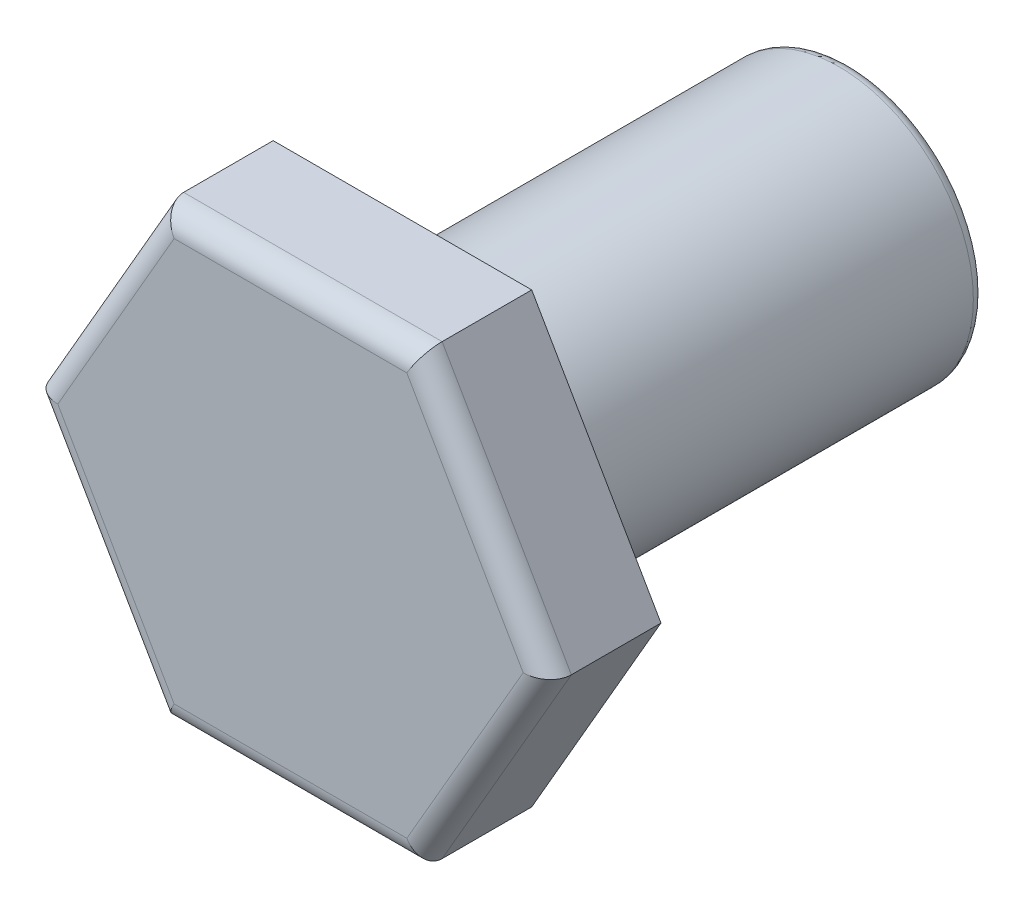
from build123d import *

# Parameters (mm, degrees)
SKETCH_1_R      = 6
EXTRUDE_1_DEPTH = 25
EXTRUDE_2_DEPTH = 5
FILLET_1_R      = 1
FILLET_2_R      = 0.5


with BuildPart() as part:
    # 草图1 → 凸台-拉伸1 (new body)
    with BuildSketch(Plane.XY):
        Circle(SKETCH_1_R)
    extrude(amount=EXTRUDE_1_DEPTH)

    # 草图3 → 凸台-拉伸2 (add)
    with BuildSketch(Plane.XY.offset(25)):
        Polygon((5.773502692, -10), (11.547005384, 0), (5.773502692, 10), (-5.773502692, 10), (-11.547005384, 0), (-5.773502692, -10), align=None)
    extrude(amount=-EXTRUDE_2_DEPTH)

    # 圆角1
    fillet_1_edges = [part.edges().sort_by_distance(p)[0] for p in [
        (0, -10, 25),
        (8.660254038, -5, 25),
        (8.660254038, 5, 25),
        (0, 10, 25),
        (-8.660254038, 5, 25),
        (-8.660254038, -5, 25),
    ]]
    fillet(fillet_1_edges, radius=FILLET_1_R)

    # 圆角2
    fillet_2_edges = [part.edges().sort_by_distance(p)[0] for p in [
        (-6, 0, 0),
    ]]
    fillet(fillet_2_edges, radius=FILLET_2_R)


solid = part.part
